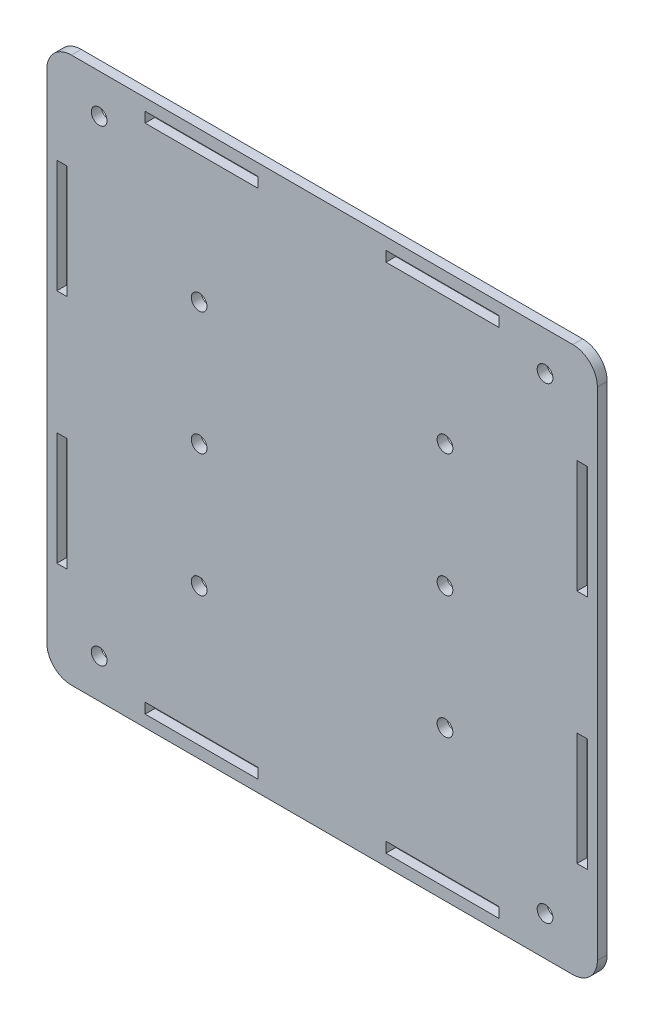
from build123d import *

# Parameters (mm, degrees)
SKETCH_1_W          = 112
SKETCH_1_H          = 111
EXTRUDE_1_DEPTH     = 2
SKETCH_2_R          = 1.6
CUT_EXTRUDE_1_DEPTH = 79.868561544
SKETCH_3_W          = 2.1
SKETCH_3_H          = 23
SKETCH_3_W_2        = 23
SKETCH_3_H_2        = 2.1
CUT_EXTRUDE_2_DEPTH = 79.868561544
SKETCH_4_R          = 1.6
CUT_EXTRUDE_3_DEPTH = 79.868561544
FILLET_1_R          = 5


with BuildPart() as part:
    # 草图1 → 凸台-拉伸1 (new body)
    with BuildSketch(Plane.XY):
        Rectangle(SKETCH_1_W, SKETCH_1_H)
    extrude(amount=EXTRUDE_1_DEPTH)

    # 草图2 → 切除-拉伸1 (cut, through all)
    with BuildSketch(Plane(origin=(0, 0, 0), x_dir=(-1, 0, 0), z_dir=(0, 0, -1))):
        with Locations((-45.35, -47.55)):
            Circle(SKETCH_2_R)
        with Locations((45.35, -47.55)):
            Circle(SKETCH_2_R)
        with Locations((45.35, 47.55)):
            Circle(SKETCH_2_R)
        with Locations((-45.35, 47.55)):
            Circle(SKETCH_2_R)
    extrude(amount=-CUT_EXTRUDE_1_DEPTH, mode=Mode.SUBTRACT)

    # 草图3 → 切除-拉伸2 (cut, through all)
    with BuildSketch(Plane(origin=(0, 0, 0), x_dir=(-1, 0, 0), z_dir=(0, 0, -1))):
        with Locations((-52.9, 24)):
            Rectangle(SKETCH_3_W, SKETCH_3_H)
        with Locations((-52.9, -24)):
            Rectangle(SKETCH_3_W, SKETCH_3_H)
        with Locations((52.9, -24)):
            Rectangle(SKETCH_3_W, SKETCH_3_H)
        with Locations((52.9, 24)):
            Rectangle(SKETCH_3_W, SKETCH_3_H)
        with Locations((-24.5, -52.05)):
            Rectangle(SKETCH_3_W_2, SKETCH_3_H_2)
        with Locations((24.5, -52.05)):
            Rectangle(SKETCH_3_W_2, SKETCH_3_H_2)
        with Locations((24.5, 52.05)):
            Rectangle(SKETCH_3_W_2, SKETCH_3_H_2)
        with Locations((-24.5, 52.05)):
            Rectangle(SKETCH_3_W_2, SKETCH_3_H_2)
    extrude(amount=-CUT_EXTRUDE_2_DEPTH, mode=Mode.SUBTRACT)

    # 草图4 → 切除-拉伸3 (cut, through all)
    with BuildSketch(Plane(origin=(0, 0, 0), x_dir=(-1, 0, 0), z_dir=(0, 0, -1))):
        with Locations((-25, -25)):
            Circle(SKETCH_4_R)
        with Locations((25, -25)):
            Circle(SKETCH_4_R)
        with Locations((25, 0)):
            Circle(SKETCH_4_R)
        with Locations((25, 25)):
            Circle(SKETCH_4_R)
        with Locations((-25, 0)):
            Circle(SKETCH_4_R)
        with Locations((-25, 25)):
            Circle(SKETCH_4_R)
    extrude(amount=-CUT_EXTRUDE_3_DEPTH, mode=Mode.SUBTRACT)

    # 圆角1
    fillet_1_edges = [part.edges().sort_by_distance(p)[0] for p in [
        (56, -55.5, 1),
        (-56, -55.5, 1),
        (-56, 55.5, 1),
        (56, 55.5, 1),
    ]]
    fillet(fillet_1_edges, radius=FILLET_1_R)


solid = part.part
